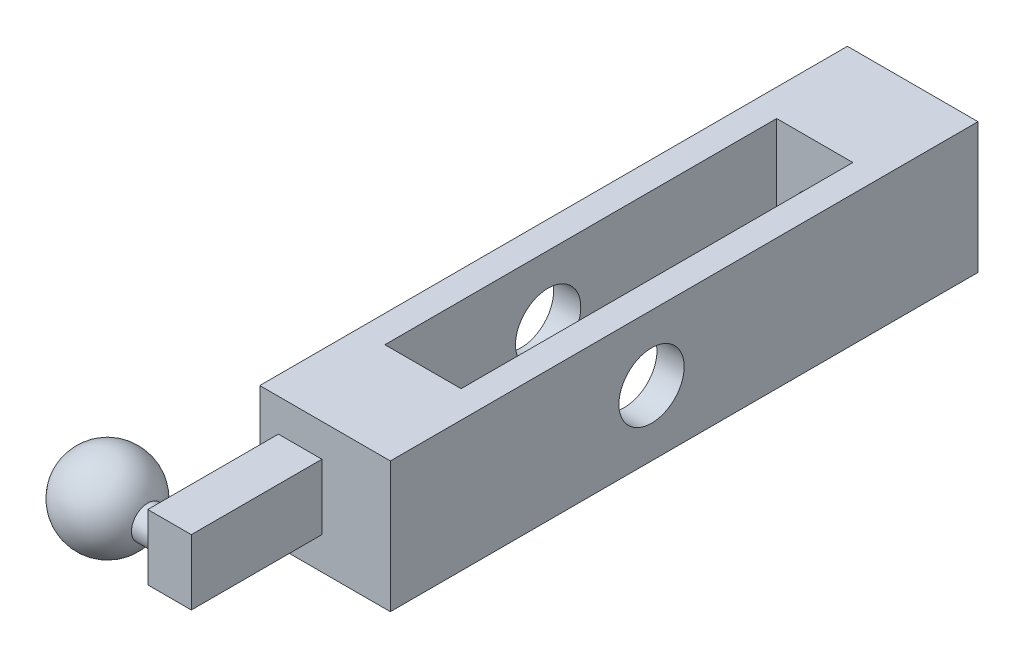
from build123d import *

# Parameters (mm, degrees)
SKETCH_1_W          = 6
SKETCH_1_H          = 6
EXTRUDE_1_DEPTH     = 27
SKETCH_2_W          = 2
SKETCH_2_H          = 3
EXTRUDE_2_DEPTH     = 6
SKETCH_3_R          = 0.75
EXTRUDE_3_DEPTH     = 1
SKETCH_5_W          = 18
SKETCH_5_H          = 3.5
CUT_EXTRUDE_1_DEPTH = 8
SKETCH_6_R          = 1.5
CUT_EXTRUDE_2_DEPTH = 8
SKETCH_7_R          = 0.9
CUT_EXTRUDE_3_DEPTH = 8


with BuildPart() as part:
    # 草图1 → 凸台-拉伸1 (new body)
    with BuildSketch(Plane.XY):
        Rectangle(SKETCH_1_W, SKETCH_1_H)
    extrude(amount=EXTRUDE_1_DEPTH)

    # 草图2 → 凸台-拉伸2 (add)
    with BuildSketch(Plane.XY.offset(27)):
        with Locations((-1.14479355, -0.004540815)):
            Rectangle(SKETCH_2_W, SKETCH_2_H)
    extrude(amount=EXTRUDE_2_DEPTH)

    # 草图3 → 凸台-拉伸3 (add)
    with BuildSketch(Plane.ZY.offset(2.14479355)):
        with Locations(Location((32, 0, 0), (0, 0, 90))):
            Circle(SKETCH_3_R)
    extrude(amount=EXTRUDE_3_DEPTH)

    # 草图4 → 旋转1 (revolve)
    with BuildSketch(Plane(origin=(0, 0, 0), x_dir=(1, 0, 0), z_dir=(0, 1, 0))):
        with BuildLine():
            Line((-3.14479355, -32), (-6.998843172, -32))
            ThreePointArc((-6.998843172, -32), (-5.380877697, -30.036826645), (-3.14479355, -31.25))
            Line((-3.14479355, -31.25), (-3.14479355, -32))
        make_face()
    revolve(axis=Axis((-3.14479355, 0, 32), (-1, 0, 0)))

    # 草图5 → 切除-拉伸1 (cut)
    with BuildSketch(Plane(origin=(0.5, 3, 0), x_dir=(0, 0, 1), z_dir=(0, -1, 0))):
        with Locations((13.5, 0.5)):
            Rectangle(SKETCH_5_W, SKETCH_5_H)
    extrude(amount=CUT_EXTRUDE_1_DEPTH, mode=Mode.SUBTRACT)

    # 草图6 → 切除-拉伸2 (cut)
    with BuildSketch(Plane.ZY.offset(3)):
        with Locations((15, 0)):
            Circle(SKETCH_6_R)
    extrude(amount=-CUT_EXTRUDE_2_DEPTH, mode=Mode.SUBTRACT)

    # 草图7 → 切除-拉伸3 (cut)
    with BuildSketch(Plane(origin=(0, 0, 0), x_dir=(-1, 0, 0), z_dir=(0, 0, -1))):
        Circle(SKETCH_7_R)
    extrude(amount=-CUT_EXTRUDE_3_DEPTH, mode=Mode.SUBTRACT)


solid = part.part
